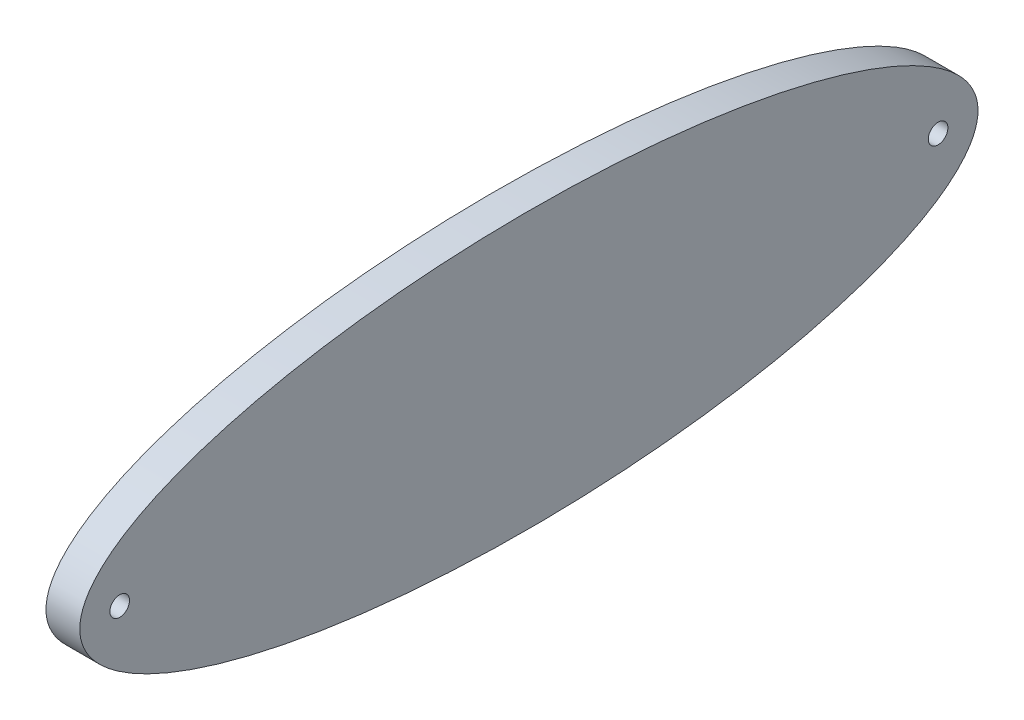
from build123d import *

# Parameters (mm, degrees)
SKETCH1_RX          = 67.5
SKETCH1_RY          = 20.7
SKETCH1_R           = 1.4732
BOSS_EXTRUDE1_DEPTH = 5.08


with BuildPart() as part:
    # Sketch1 → Boss-Extrude1 (new body)
    with BuildSketch(Plane(origin=(0, 0, 0), x_dir=(0, 0, -1), z_dir=(1, 0, 0))):
        with Locations((0, 0)):
            Ellipse(SKETCH1_RX, SKETCH1_RY)
        with Locations((-61.5, 0)):
            Circle(SKETCH1_R, mode=Mode.SUBTRACT)
        with Locations((61.5, 0)):
            Circle(SKETCH1_R, mode=Mode.SUBTRACT)
    extrude(amount=BOSS_EXTRUDE1_DEPTH)


solid = part.part
